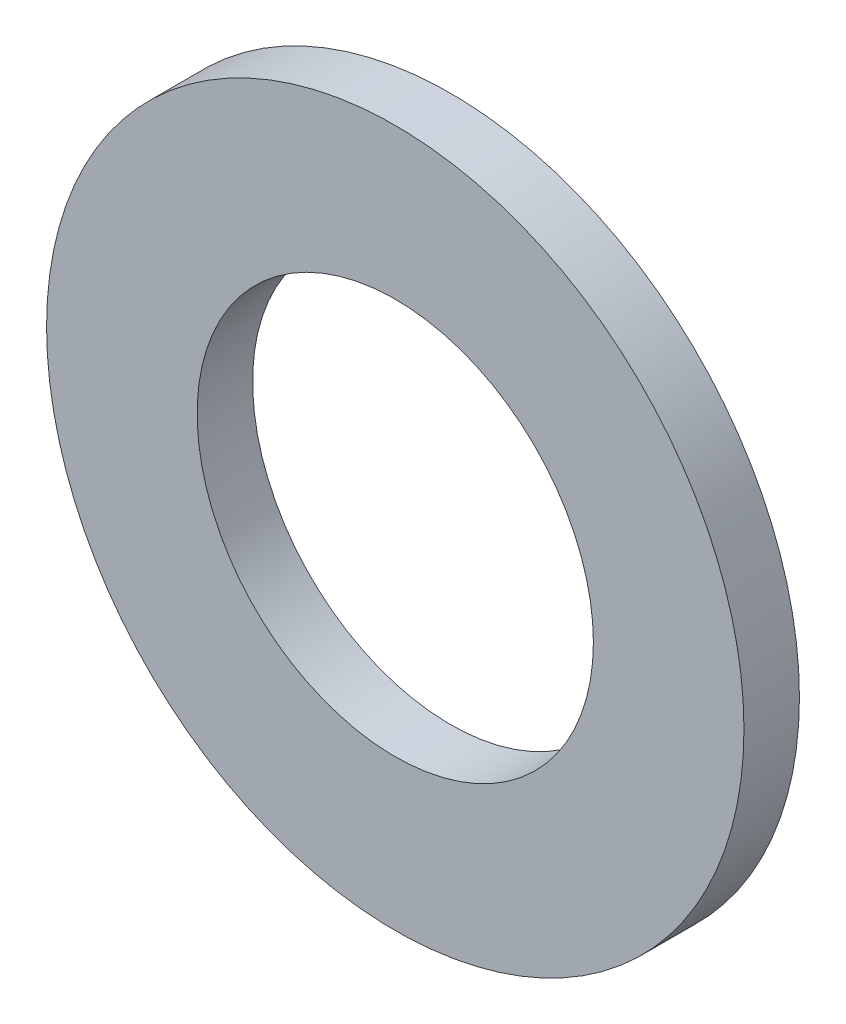
from build123d import *

# Parameters (mm, degrees)
SKETCH1_R           = 22
SKETCH1_R_2         = 12.5
BOSS_EXTRUDE1_DEPTH = 1.75


with BuildPart() as part:
    # Sketch1 → Boss-Extrude1 (new, symmetric)
    with BuildSketch(Plane.XY):
        Circle(SKETCH1_R)
        Circle(SKETCH1_R_2, mode=Mode.SUBTRACT)
    extrude(amount=BOSS_EXTRUDE1_DEPTH, both=True)


solid = part.part
